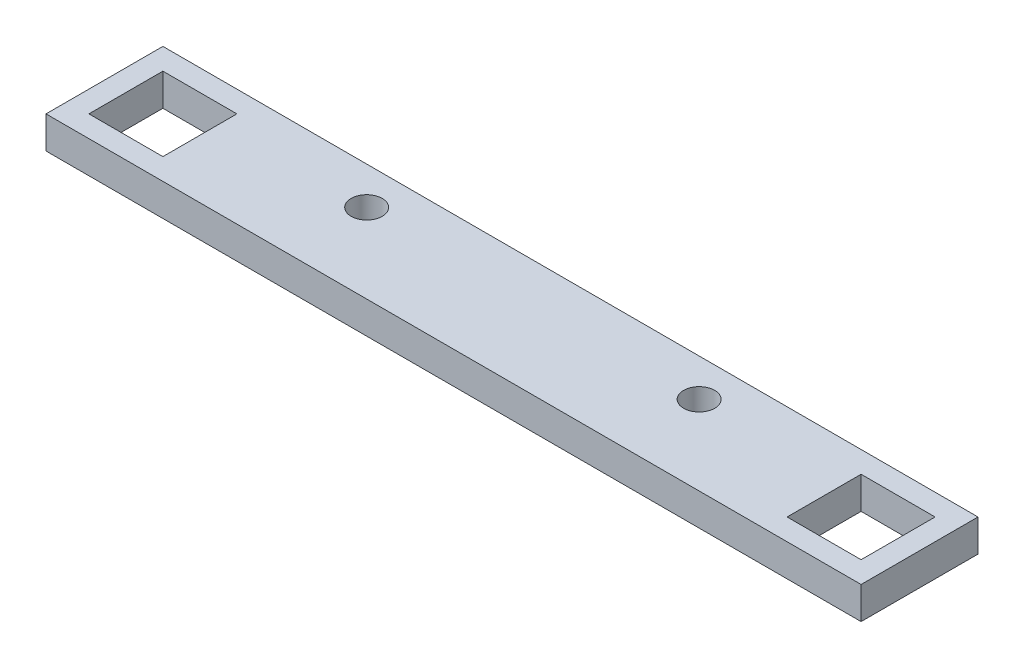
from build123d import *

# Parameters (mm, degrees)
ESQUISSE1_W        = 76
ESQUISSE1_H        = 10.9
ESQUISSE1_R        = 1.45
ESQUISSE1_W_2      = 6.9
ESQUISSE1_H_2      = 6.9
BOSS_EXTRU_1_DEPTH = 3


with BuildPart() as part:
    # Esquisse1 → Boss.-Extru.1 (new body)
    with BuildSketch(Plane(origin=(0, 0, 0), x_dir=(1, 0, 0), z_dir=(0, 1, 0))):
        with Locations((38, 5.45)):
            Rectangle(ESQUISSE1_W, ESQUISSE1_H)
        with Locations(Location((22.5, 7.4, 0), (0, 0, 270))):
            Circle(ESQUISSE1_R, mode=Mode.SUBTRACT)
        with Locations(Location((53.5, 7.4, 0), (0, 0, 270))):
            Circle(ESQUISSE1_R, mode=Mode.SUBTRACT)
        with Locations((5.45, 5.45)):
            Rectangle(ESQUISSE1_W_2, ESQUISSE1_H_2, mode=Mode.SUBTRACT)
        with Locations((70.55, 5.45)):
            Rectangle(ESQUISSE1_W_2, ESQUISSE1_H_2, mode=Mode.SUBTRACT)
    extrude(amount=BOSS_EXTRU_1_DEPTH)


solid = part.part
